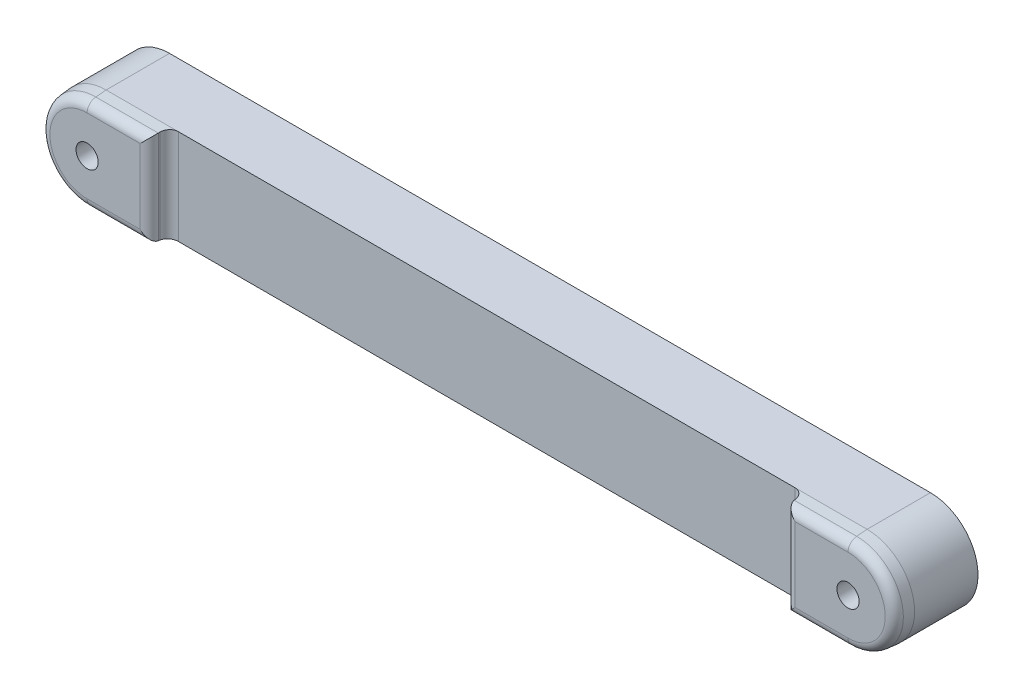
from build123d import *

# Parameters (mm, degrees)
BOSS_EXTRUDE1_DEPTH  = 10
BOSS_EXTRUDE2_DEPTH  = 3
BOSS_EXTRUDE2_TAPER  = 5
FILLET1_R            = 1.5
SKETCH3_R            = 1.75
CUT_EXTRUDE1_DEPTH   = 70.14839116
SKETCH4_R            = 4
CUT_EXTRUDE2_DEPTH   = 10
FILLET1_OF_MIRROR3_R = 1.5
CHAMFER1_SIZE        = 2


with BuildPart() as part:
    # Sketch1 → Boss-Extrude1 (new body)
    with BuildSketch(Plane.XY):
        with BuildLine():
            Line((-60, 7.5), (60, 7.5))
            ThreePointArc((60, 7.5), (67.5, 0), (60, -7.5))
            Line((60, -7.5), (-60, -7.5))
            ThreePointArc((-60, -7.5), (-67.5, 0), (-60, 7.5))
        make_face()
    extrude(amount=BOSS_EXTRUDE1_DEPTH)

    # Sketch2 → Boss-Extrude2 (add)
    with BuildSketch(Plane.XY.offset(10)):
        with BuildLine():
            Line((-50, -7.5), (-50, 7.5))
            Line((-50, 7.5), (-60, 7.5))
            ThreePointArc((-60, 7.5), (-67.5, 0), (-60, -7.5))
            Line((-60, -7.5), (-50, -7.5))
        make_face()
    boss_extrude2 = extrude(amount=BOSS_EXTRUDE2_DEPTH, taper=BOSS_EXTRUDE2_TAPER)

    # Fillet1
    fillet1_edges = [part.edges().sort_by_distance(p)[0] for p in [
        (-50.262465991, 0, 13),
        (-55.131232995, 7.237534009, 13),
        (-67.237534009, 0, 13),
        (-55.131232995, -7.237534009, 13),
        (-50, 0, 10),
    ]]
    fillet(fillet1_edges, radius=FILLET1_R)

    # Sketch3 → Cut-Extrude1 (cut, through all)
    with BuildSketch(Plane.XY.offset(13)):
        with Locations((-60, 0)):
            Circle(SKETCH3_R)
    cut_extrude1 = extrude(amount=-CUT_EXTRUDE1_DEPTH, mode=Mode.SUBTRACT)

    # Sketch4 → Cut-Extrude2 (cut)
    with BuildSketch(Plane(origin=(0, 0, 0), x_dir=(-1, 0, 0), z_dir=(0, 0, -1))):
        with Locations((60, 0)):
            Circle(SKETCH4_R)
    cut_extrude2 = extrude(amount=-CUT_EXTRUDE2_DEPTH, mode=Mode.SUBTRACT)

    # Mirror3: Boss-Extrude2, Cut-Extrude1, Cut-Extrude2 across plane
    add(boss_extrude2.mirror(Plane(origin=(0, 0, 0), x_dir=(0, 0, 1), z_dir=(1, 0, 0))))
    add(cut_extrude1.mirror(Plane(origin=(0, 0, 0), x_dir=(0, 0, 1), z_dir=(1, 0, 0))), mode=Mode.SUBTRACT)
    add(cut_extrude2.mirror(Plane(origin=(0, 0, 0), x_dir=(0, 0, 1), z_dir=(1, 0, 0))), mode=Mode.SUBTRACT)

    # Fillet1 of Mirror3
    fillet1_of_mirror3_edges = [part.edges().sort_by_distance(p)[0] for p in [
        (50.262465991, 0, 13),
        (55.131232995, 7.237534009, 13),
        (67.237534009, 0, 13),
        (55.131232995, -7.237534009, 13),
        (50, 0, 10),
    ]]
    fillet(fillet1_of_mirror3_edges, radius=FILLET1_OF_MIRROR3_R)

    # Chamfer1
    chamfer1_edges = [part.edges().sort_by_distance(p)[0] for p in [
        (56, 0, 10),
        (-56, 0, 10),
    ]]
    chamfer(chamfer1_edges, length=CHAMFER1_SIZE)


solid = part.part
